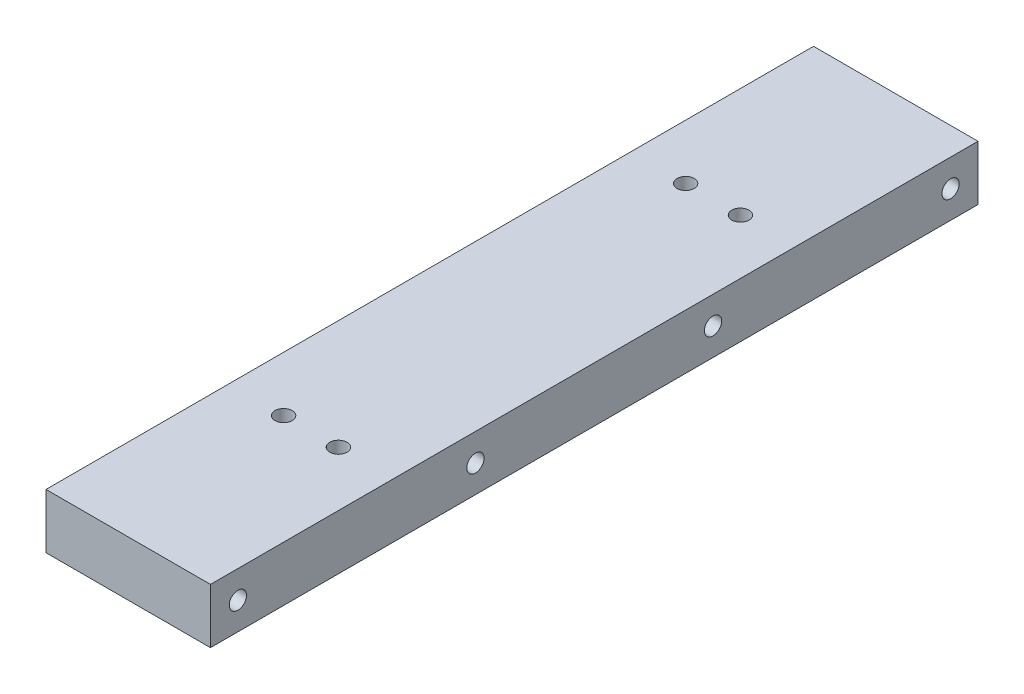
from build123d import *

# Parameters (mm, degrees)
SKETCH2_W             = 28.575
SKETCH2_H             = 133.35
BOSS_EXTRUDE1_DEPTH   = 9.525
F_3_0MM_DOWEL_HOLE1_D = 3
LPATTERN1_COUNT       = 4
LPATTERN1_PITCH       = 41.275
SKETCH8_R             = 1.5
CUT_EXTRUDE2_DEPTH    = 137.709468399


with BuildPart() as part:
    # Sketch2 → Boss-Extrude1 (new body)
    with BuildSketch(Plane(origin=(0, 0, 0), x_dir=(1, 0, 0), z_dir=(0, 1, 0))):
        with Locations((14.2875, 66.675)):
            Rectangle(SKETCH2_W, SKETCH2_H)
    extrude(amount=BOSS_EXTRUDE1_DEPTH)

    # Ø3.0mm Dowel Hole1 (through all)
    with Locations(Plane(origin=(28.575, 0, 0), x_dir=(0, 0, -1), z_dir=(1, 0, 0))):
        with Locations((4.7625, 4.7625)):
            f_3_0mm_dowel_hole1 = Hole(F_3_0MM_DOWEL_HOLE1_D / 2)

    # LPattern1: Ø3.0mm Dowel Hole1 ×4
    with Locations(*[(0, 0, -i * LPATTERN1_PITCH) for i in range(1, LPATTERN1_COUNT)]):
        add(f_3_0mm_dowel_hole1, mode=Mode.SUBTRACT)

    # Sketch8 → Cut-Extrude2 (cut, through all)
    with BuildSketch(Plane.XZ):
        with Locations(Location((9.525, -31.75, 0), (0, 0, 270))):
            Circle(SKETCH8_R)
        with Locations(Location((9.525, -101.6, 0), (0, 0, 270))):
            Circle(SKETCH8_R)
        with Locations(Location((19.05, -101.6, 0), (0, 0, 270))):
            Circle(SKETCH8_R)
        with Locations(Location((19.05, -31.75, 0), (0, 0, 270))):
            Circle(SKETCH8_R)
    extrude(amount=-CUT_EXTRUDE2_DEPTH, mode=Mode.SUBTRACT)


solid = part.part
